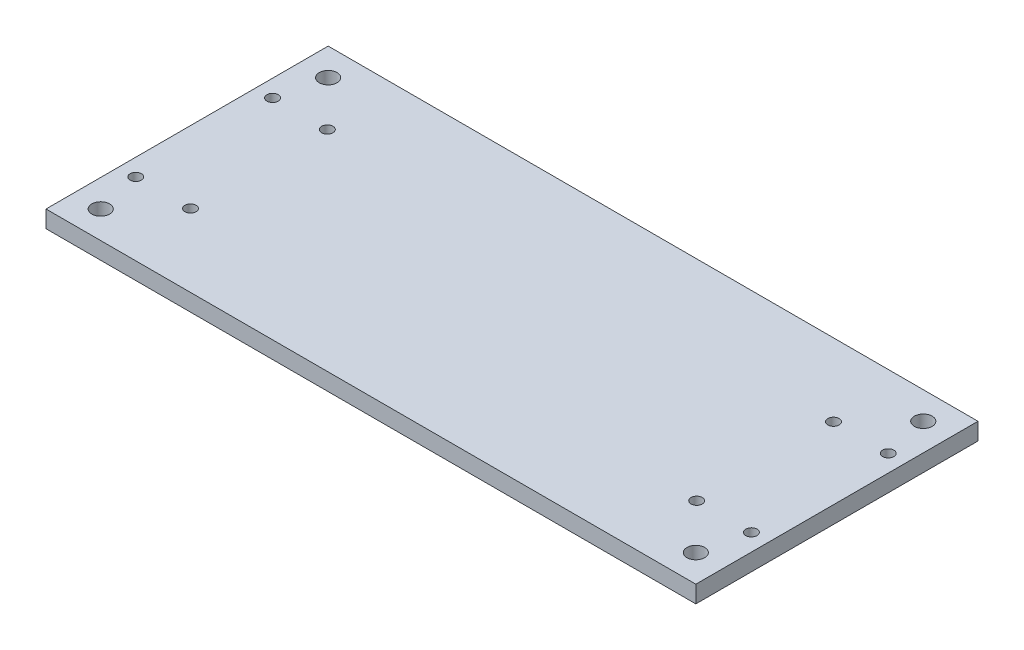
from build123d import *

# Parameters (mm, degrees)
SKETCH_1_W          = 347.5
SKETCH_1_H          = 165
SKETCH_1_R          = 2.6
EXTRUDE_1_DEPTH     = 5
SKETCH_2_W          = 157.5
SKETCH_2_H          = 82.5
SKETCH_2_H_2        = 55.334629905
SKETCH_2_H_3        = 27.165370095
SKETCH_2_R          = 2.6
SKETCH_2_W_2        = 173.75
SKETCH_2_W_3        = 16.25
CUT_EXTRUDE_2_DEPTH = 5
SKETCH_4_R          = 2.6
CUT_EXTRUDE_3_DEPTH = 5
SKETCH_5_R          = 1.65
CUT_EXTRUDE_4_DEPTH = 10


with BuildPart() as part:
    # 草图1 → 凸台-拉伸1 (new body)
    with BuildSketch(Plane(origin=(0, 5, 0), x_dir=(1, 0, 0), z_dir=(0, 1, 0))):
        Rectangle(SKETCH_1_W, SKETCH_1_H)
        with Locations(Location((-163.75, -70.5, 0), (0, 0, 90))):
            Circle(SKETCH_1_R, mode=Mode.SUBTRACT)
        with Locations(Location((-163.75, -60.5, 0), (0, 0, 90))):
            Circle(SKETCH_1_R, mode=Mode.SUBTRACT)
        with Locations(Location((163.75, -60.5, 0), (0, 0, 90))):
            Circle(SKETCH_1_R, mode=Mode.SUBTRACT)
        with Locations(Location((163.75, -70.5, 0), (0, 0, 90))):
            Circle(SKETCH_1_R, mode=Mode.SUBTRACT)
    extrude(amount=-EXTRUDE_1_DEPTH)

    # 草图2 → 切除-拉伸2 (cut)
    # profile 1 of 7: a face of its own
    with BuildSketch(Plane(origin=(0, 5, 0), x_dir=(1, 0, 0), z_dir=(0, 1, 0))):
        with Locations((-95, 41.25)):
            Rectangle(SKETCH_2_W, SKETCH_2_H)
    # profile 2 of 7: a face of its own
    with BuildSketch(Plane(origin=(0, 5, 0), x_dir=(1, 0, 0), z_dir=(0, 1, 0))):
        with Locations((-95, -27.667314952)):
            Rectangle(SKETCH_2_W, SKETCH_2_H_2)
    # profile 3 of 7: a face of its own
    with BuildSketch(Plane(origin=(0, 5, 0), x_dir=(1, 0, 0), z_dir=(0, 1, 0))):
        with Locations((-95, -68.917314952)):
            Rectangle(SKETCH_2_W, SKETCH_2_H_3)
        with Locations((-163.75, -70.5)):
            Circle(SKETCH_2_R, mode=Mode.SUBTRACT)
        with Locations((-163.75, -60.5)):
            Circle(SKETCH_2_R, mode=Mode.SUBTRACT)
    # profile 4 of 7: a face of its own
    with BuildSketch(Plane(origin=(0, 5, 0), x_dir=(1, 0, 0), z_dir=(0, 1, 0))):
        with Locations((86.875, -68.917314952)):
            Rectangle(SKETCH_2_W_2, SKETCH_2_H_3)
        with Locations((163.75, -70.5)):
            Circle(SKETCH_2_R, mode=Mode.SUBTRACT)
        with Locations((163.75, -60.5)):
            Circle(SKETCH_2_R, mode=Mode.SUBTRACT)
    # profile 5 of 7: a face of its own
    with BuildSketch(Plane(origin=(0, 5, 0), x_dir=(1, 0, 0), z_dir=(0, 1, 0))):
        with Locations((-8.125, -68.917314952)):
            Rectangle(SKETCH_2_W_3, SKETCH_2_H_3)
    # profile 6 of 7: a face of its own
    with BuildSketch(Plane(origin=(0, 5, 0), x_dir=(1, 0, 0), z_dir=(0, 1, 0))):
        with Locations((-8.125, -27.667314952)):
            Rectangle(SKETCH_2_W_3, SKETCH_2_H_2)
    # profile 7 of 7: a face of its own
    with BuildSketch(Plane(origin=(0, 5, 0), x_dir=(1, 0, 0), z_dir=(0, 1, 0))):
        with Locations((86.875, -27.667314952)):
            Rectangle(SKETCH_2_W_2, SKETCH_2_H_2)
    extrude(amount=-CUT_EXTRUDE_2_DEPTH, mode=Mode.SUBTRACT)

    # 草图4 → 切除-拉伸3 (cut)
    with BuildSketch(Plane(origin=(0, 5, 0), x_dir=(1, 0, 0), z_dir=(0, 1, 0))):
        with Locations(Location((165.75, 74.5, 0), (0, 0, 270))):
            Circle(SKETCH_4_R)
        with Locations(Location((165.75, 8, 0), (0, 0, 270))):
            Circle(SKETCH_4_R)
        with Locations(Location((-8.25, 74.5, 0), (0, 0, 270))):
            Circle(SKETCH_4_R)
        with Locations(Location((-8.25, 8, 0), (0, 0, 270))):
            Circle(SKETCH_4_R)
    extrude(amount=-CUT_EXTRUDE_3_DEPTH, mode=Mode.SUBTRACT)

    # 草图5 → 切除-拉伸4 (cut)
    with BuildSketch(Plane.XZ):
        with Locations(Location((-11.25, -61.25, 0), (0, 0, 270))):
            Circle(SKETCH_5_R)
        with Locations(Location((4.75, -61.25, 0), (0, 0, 270))):
            Circle(SKETCH_5_R)
        with Locations(Location((4.75, -21.25, 0), (0, 0, 270))):
            Circle(SKETCH_5_R)
        with Locations(Location((152.75, -61.25, 0), (0, 0, 270))):
            Circle(SKETCH_5_R)
        with Locations(Location((168.75, -61.25, 0), (0, 0, 270))):
            Circle(SKETCH_5_R)
        with Locations(Location((152.75, -21.25, 0), (0, 0, 270))):
            Circle(SKETCH_5_R)
        with Locations(Location((168.75, -21.25, 0), (0, 0, 270))):
            Circle(SKETCH_5_R)
        with Locations(Location((-11.25, -21.25, 0), (0, 0, 270))):
            Circle(SKETCH_5_R)
    extrude(amount=-CUT_EXTRUDE_4_DEPTH, mode=Mode.SUBTRACT)


solid = part.part
